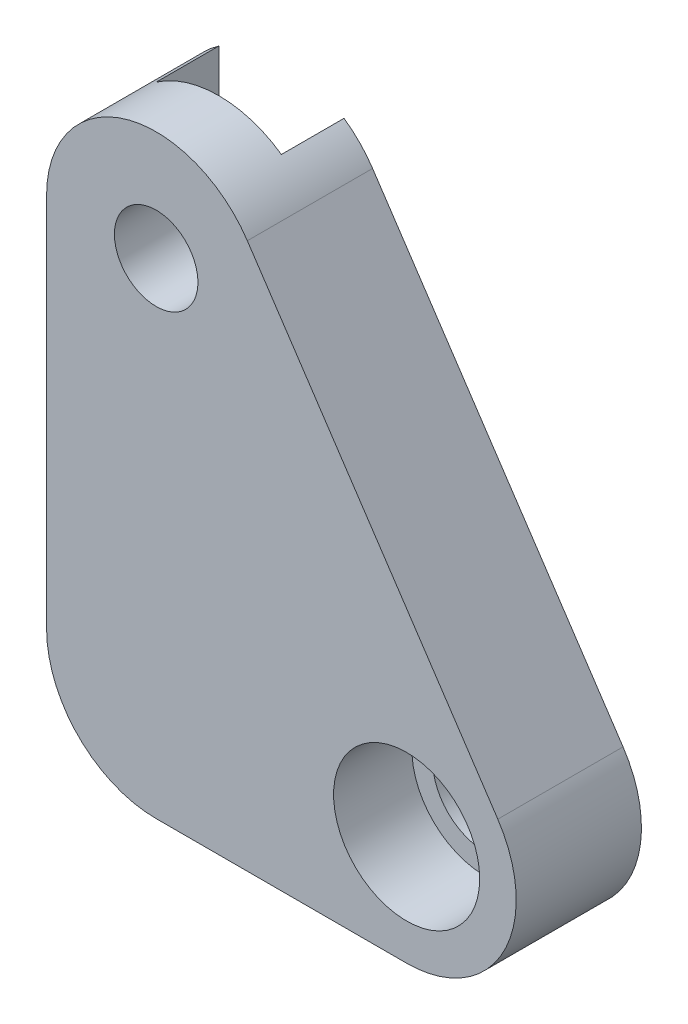
from build123d import *

# Parameters (mm, degrees)
EXTRUSION1_DEPTH                 = 24
ENL_V_MAT_EXTRU_1_REACH          = 133.799
ESQUISSE2_W                      = 24
ESQUISSE2_H                      = 12
DIAM_TRE_DU_PER_AGE_M16_0_16_1_D = 16
PER_AGE1_D                       = 20
PER_AGE1_CBORE_D                 = 28
PER_AGE1_CBORE_DEPTH             = 15
CONG_1_R                         = 21
ESQUISSE7_W                      = 5.748189094
ESQUISSE7_H                      = 0.872373353
ENL_V_MAT_EXTRU_2_DEPTH          = 1
R_P_TITION_LIN_AIRE1_COUNT       = 44
R_P_TITION_LIN_AIRE1_PITCH       = 2


with BuildPart() as part:
    # Esquisse1 → Extrusion1 (new body)
    with BuildSketch(Plane(origin=(0, 0, 6), x_dir=(-1, 0, 0), z_dir=(0, 0, -1))):
        with BuildLine():
            Line((31.050048828, -21), (31.050048828, 72))
            ThreePointArc((31.050048828, 72), (16.135515951, 92.098932556), (-7.423007353, 83.648704121))
            Line((-7.423007353, 83.648704121), (-55.423007353, 11.648704121))
            ThreePointArc((-55.423007353, 11.648704121), (-56.465117746, -9.909016436), (-37.949951172, -21))
            Line((-37.949951172, -21), (31.050048828, -21))
        make_face()
    extrude(amount=-EXTRUSION1_DEPTH)

    # Esquisse2 → Enlèv. mat.-Extru.1 (cut, up to next)
    with BuildSketch(Plane.XZ.offset(21), mode=Mode.PRIVATE) as enl_v_mat_extru_1_sk1:
        with Locations((-10.050048828, 12)):
            Rectangle(ESQUISSE2_W, ESQUISSE2_H)
    enl_v_mat_extru_1_tool1 = extrude(enl_v_mat_extru_1_sk1.sketch, amount=-ENL_V_MAT_EXTRU_1_REACH, mode=Mode.PRIVATE) & part.part
    add(enl_v_mat_extru_1_tool1.solids().sort_by_distance((-10.050049, -21, 12))[0], mode=Mode.SUBTRACT)

    # Diamètre du perçage M16.0 (16)1 (through all)
    with Locations(Plane(origin=(0, 0, 18), x_dir=(-1, 0, 0), z_dir=(0, 0, -1))):
        with Locations((10.050048828, 72)):
            Hole(DIAM_TRE_DU_PER_AGE_M16_0_16_1_D / 2)

    # Perçage1 (through all)
    with Locations(Plane.XY.offset(30)):
        with Locations((37.949951172, 0)):
            CounterBoreHole(PER_AGE1_D / 2, PER_AGE1_CBORE_D / 2, PER_AGE1_CBORE_DEPTH)

    # Congé1
    cong_1_edges = [part.edges().sort_by_distance(p)[0] for p in [
        (-31.050048828, -21, 18),
    ]]
    fillet(cong_1_edges, radius=CONG_1_R)

    # Esquisse7 → Enlèv. mat.-Extru.2 (cut)
    with BuildSketch(Plane(origin=(0, 0, 6), x_dir=(-1, 0, 0), z_dir=(0, 0, -1))):
        with Locations((-4.824045719, 73.61986696)):
            Rectangle(ESQUISSE7_W, ESQUISSE7_H)
    enl_v_mat_extru_2 = extrude(amount=-ENL_V_MAT_EXTRU_2_DEPTH, mode=Mode.SUBTRACT)

    # Répétition linéaire1: Enlèv. mat.-Extru.2 ×44
    with Locations(*[(0, -i * R_P_TITION_LIN_AIRE1_PITCH, 0) for i in range(1, R_P_TITION_LIN_AIRE1_COUNT)]):
        add(enl_v_mat_extru_2, mode=Mode.SUBTRACT)


solid = part.part
